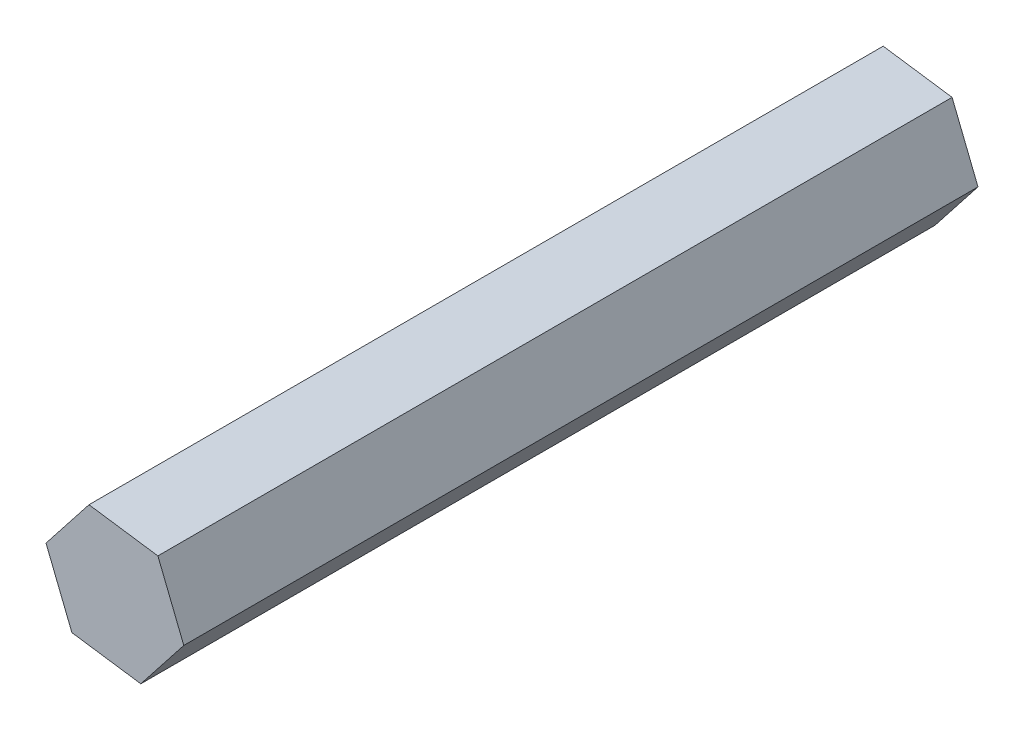
from build123d import *

# Parameters (mm, degrees)
BOSS_EXTRUDE1_DEPTH = 83.668


with BuildPart() as part:
    # Sketch1 → Boss-Extrude1 (new body)
    with BuildSketch(Plane.XY):
        Polygon((4.528723086, 5.766628178), (-2.729684953, 6.805303328), (-7.258408039, 1.03867515), (-4.528723086, -5.766628178), (2.729684953, -6.805303328), (7.258408039, -1.03867515), align=None)
    extrude(amount=BOSS_EXTRUDE1_DEPTH)


solid = part.part
